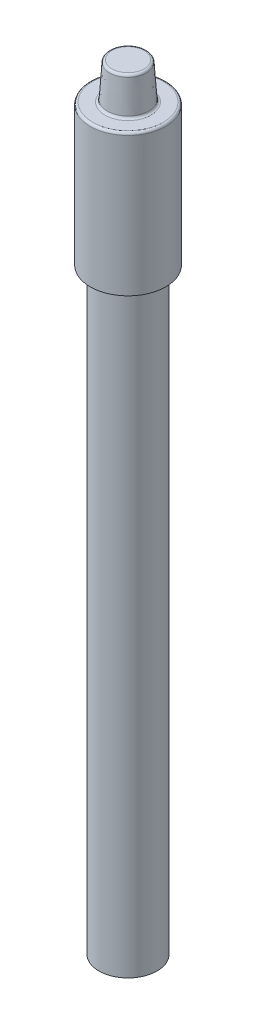
from build123d import *

# Parameters (mm, degrees)
CUT_EXTRUDE1_DEPTH = 162.927340767
FILLET1_R          = 0.508


with BuildPart() as part:
    # Sketch1 → Revolve1 (revolve)
    with BuildSketch(Plane.XY, mode=Mode.PRIVATE) as revolve1_sk:
        Polygon((0, 161.544), (3.81, 161.544), (4.318, 153.924), (7.874, 153.924), (7.874, 124.46), (6.0579, 124.46), (6.0579, 0), (0, 0), align=None)
    revolve(revolve1_sk.sketch.rotate(Axis((0, 0, 0), (0, 1, 0)), 90), axis=Axis((0, 0, 0), (0, 1, 0)))

    # Sketch2 → Cut-Extrude1 (cut, through all)
    with BuildSketch(Plane.XY):
        with BuildLine():
            Line((-1.5875, 7.9375), (-1.5875, 10.8585))
            ThreePointArc((-1.5875, 10.8585), (0, 12.446), (1.5875, 10.8585))
            Line((1.5875, 10.8585), (1.5875, 7.9375))
            ThreePointArc((1.5875, 7.9375), (0, 6.35), (-1.5875, 7.9375))
        make_face()
    extrude(amount=-CUT_EXTRUDE1_DEPTH, mode=Mode.SUBTRACT)

    # Fillet1
    fillet1_edges = [part.edges().sort_by_distance(p)[0] for p in [
        (0, 153.924, 7.874),
        (0, 153.924, 4.318),
        (0, 161.544, 3.81),
    ]]
    fillet(fillet1_edges, radius=FILLET1_R)


solid = part.part
